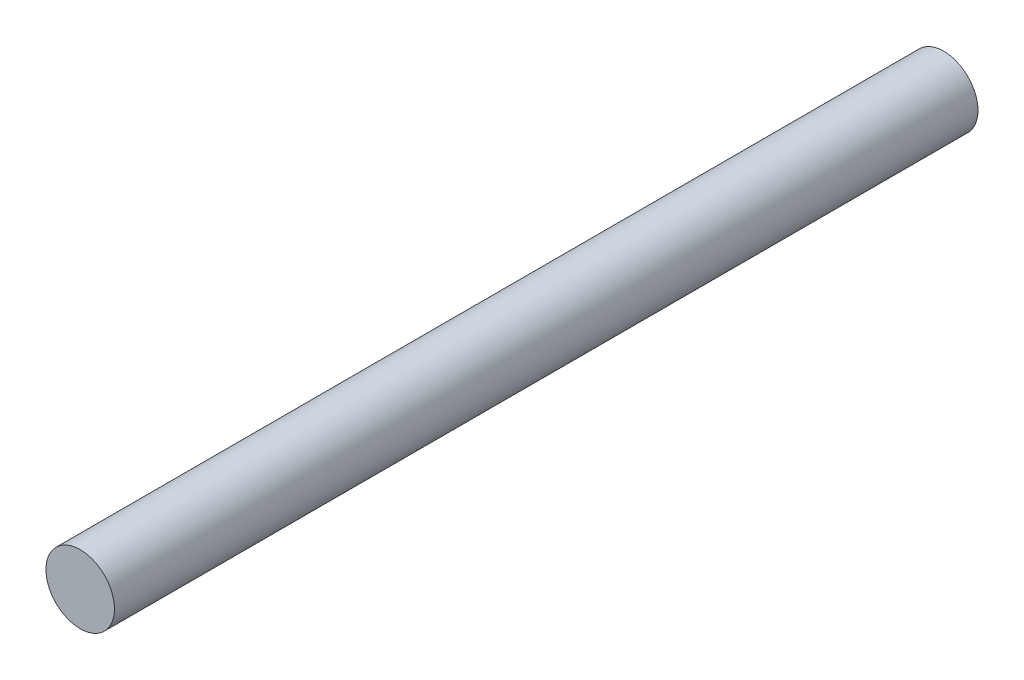
from build123d import *

# Parameters (mm, degrees)
SKETCH1_R           = 6.35
BOSS_EXTRUDE1_DEPTH = 160


with BuildPart() as part:
    # Sketch1 → Boss-Extrude1 (new body)
    with BuildSketch(Plane.XY):
        Circle(SKETCH1_R)
    extrude(amount=BOSS_EXTRUDE1_DEPTH)


solid = part.part
